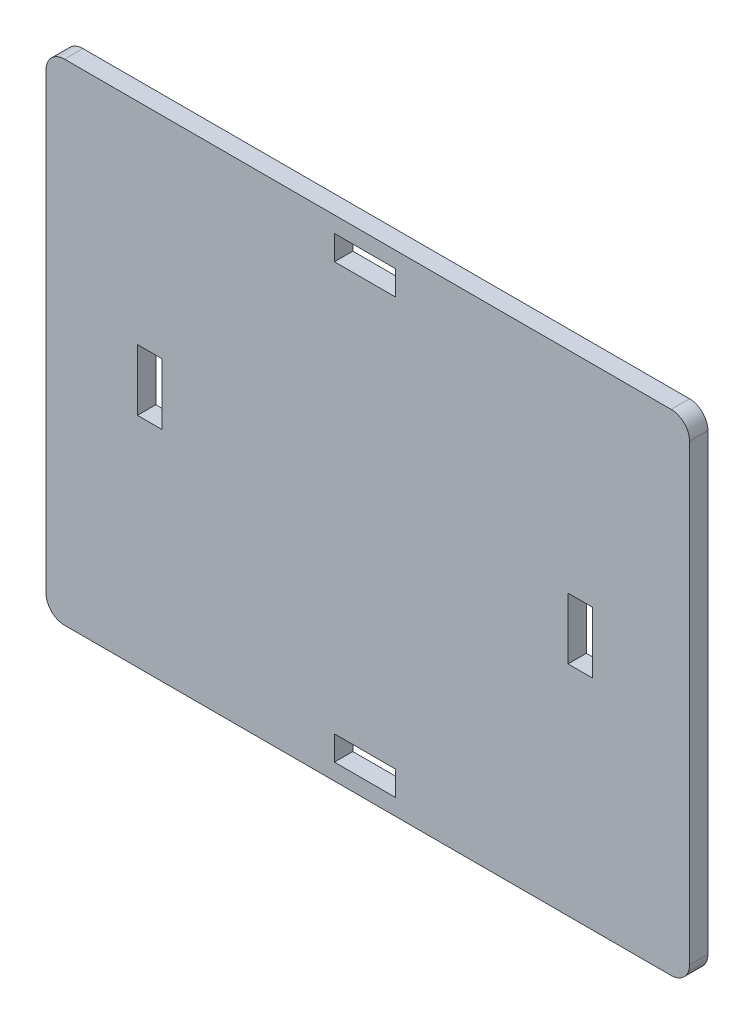
from build123d import *

# Parameters (mm, degrees)
SKETCH1_W           = 105
SKETCH1_H           = 80
BOSS_EXTRUDE1_DEPTH = 3
SKETCH3_R           = 3.75
CUT_EXTRUDE1_DEPTH  = 2.2
SKETCH4_W           = 10
SKETCH4_H           = 4
SKETCH4_W_2         = 4
SKETCH4_H_2         = 10
CUT_EXTRUDE2_DEPTH  = 10
FILLET2_R           = 3
FILLET3_R           = 3


with BuildPart() as part:
    # Sketch1 → Boss-Extrude1 (new body)
    with BuildSketch(Plane.XY):
        Rectangle(SKETCH1_W, SKETCH1_H)
    extrude(amount=BOSS_EXTRUDE1_DEPTH)

    # Sketch3 → Cut-Extrude1 (cut)
    with BuildSketch(Plane(origin=(0, 0, 0), x_dir=(-1, 0, 0), z_dir=(0, 0, -1))):
        with Locations((-24.509514806, 24.509514806)):
            Circle(SKETCH3_R)
        with Locations((24.509514806, 24.509514806)):
            Circle(SKETCH3_R)
        with Locations((24.509514806, -24.509514806)):
            Circle(SKETCH3_R)
        with Locations((-24.509514806, -24.509514806)):
            Circle(SKETCH3_R)
    extrude(amount=-CUT_EXTRUDE1_DEPTH, mode=Mode.SUBTRACT)

    # Sketch4 → Cut-Extrude2 (cut)
    with BuildSketch(Plane.XY.offset(3)):
        with Locations((-0.446296315, 35.38913846)):
            Rectangle(SKETCH4_W, SKETCH4_H)
        with Locations((-0.446296315, -35.324542102)):
            Rectangle(SKETCH4_W, SKETCH4_H)
        with Locations((-35.586810408, 0.617671805)):
            Rectangle(SKETCH4_W_2, SKETCH4_H_2)
        with Locations((34.669298403, 0.617671805)):
            Rectangle(SKETCH4_W_2, SKETCH4_H_2)
    extrude(amount=-CUT_EXTRUDE2_DEPTH, mode=Mode.SUBTRACT)

    # Fillet2
    fillet2_edges = [part.edges().sort_by_distance(p)[0] for p in [
        (-52.5, -40, 1.5),
    ]]
    fillet(fillet2_edges, radius=FILLET2_R)

    # Fillet3
    fillet3_edges = [part.edges().sort_by_distance(p)[0] for p in [
        (-52.5, 40, 1.5),
        (52.5, 40, 1.5),
        (52.5, -40, 1.5),
    ]]
    fillet(fillet3_edges, radius=FILLET3_R)


solid = part.part
